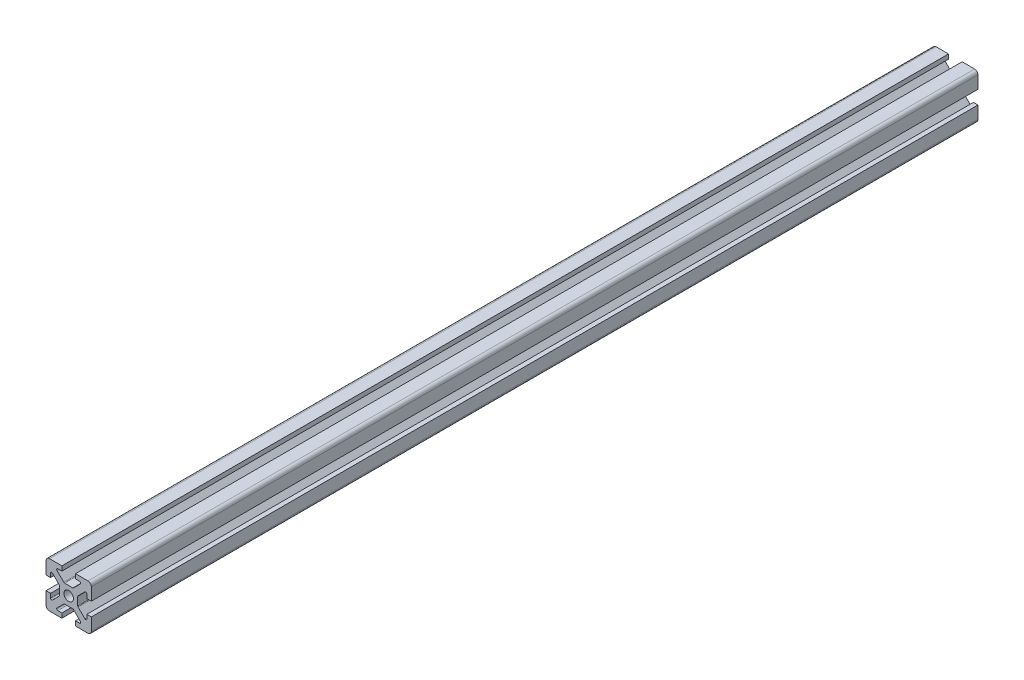
from build123d import *

# Parameters (mm, degrees)
SKETCH_1_W          = 20
SKETCH_1_H          = 20
EXTRUDE_1_DEPTH     = 391
FILLET_1_R          = 1.5
SKETCH_2_R          = 2.1
CUT_EXTRUDE_1_DEPTH = 392.255670885


with BuildPart() as part:
    # 草圖1 → 填料-伸長1 (new body)
    with BuildSketch(Plane.XY):
        Rectangle(SKETCH_1_W, SKETCH_1_H)
    extrude(amount=EXTRUDE_1_DEPTH)

    # 圓角1
    fillet_1_edges = [part.edges().sort_by_distance(p)[0] for p in [
        (-10, 10, 195.5),
        (10, 10, 195.5),
        (10, -10, 195.5),
        (-10, -10, 195.5),
    ]]
    fillet(fillet_1_edges, radius=FILLET_1_R)

    # 草圖2 → 除料-伸長1 (cut, through all)
    with BuildSketch(Plane.XY.offset(391)):
        Circle(SKETCH_2_R)
        with BuildLine():
            Line((10, 3), (8, 3))
            Line((8, 3), (8, 4.792893219))
            ThreePointArc((8, 4.792893219), (7.691341716, 5.254832985), (7.146446609, 5.146446609))
            Line((7.146446609, 5.146446609), (4.146446609, 2.146446609))
            ThreePointArc((4.146446609, 2.146446609), (4.038060234, 1.984234935), (4, 1.792893219))
            Line((4, 1.792893219), (4, -1.792893219))
            ThreePointArc((4, -1.792893219), (4.038060234, -1.984234935), (4.146446609, -2.146446609))
            Line((4.146446609, -2.146446609), (7.146446609, -5.146446609))
            ThreePointArc((7.146446609, -5.146446609), (7.691341716, -5.254832985), (8, -4.792893219))
            Line((8, -4.792893219), (8, -3))
            Line((8, -3), (10, -3))
            Line((10, -3), (10, 3))
        make_face()
        with BuildLine():
            Line((-3, -10), (3, -10))
            Line((3, -10), (3, -8))
            Line((3, -8), (4.792893219, -8))
            ThreePointArc((4.792893219, -8), (5.254832985, -7.691341716), (5.146446609, -7.146446609))
            Line((5.146446609, -7.146446609), (2.146446609, -4.146446609))
            ThreePointArc((2.146446609, -4.146446609), (1.984234935, -4.038060234), (1.792893219, -4))
            Line((1.792893219, -4), (-1.792893219, -4))
            ThreePointArc((-1.792893219, -4), (-1.984234935, -4.038060234), (-2.146446609, -4.146446609))
            Line((-2.146446609, -4.146446609), (-5.146446609, -7.146446609))
            ThreePointArc((-5.146446609, -7.146446609), (-5.254832985, -7.691341716), (-4.792893219, -8))
            Line((-4.792893219, -8), (-3, -8))
            Line((-3, -8), (-3, -10))
        make_face()
        with BuildLine():
            Line((-10, 3), (-10, -3))
            Line((-10, -3), (-8, -3))
            Line((-8, -3), (-8, -4.792893219))
            ThreePointArc((-8, -4.792893219), (-7.691341716, -5.254832985), (-7.146446609, -5.146446609))
            Line((-7.146446609, -5.146446609), (-4.146446609, -2.146446609))
            ThreePointArc((-4.146446609, -2.146446609), (-4.038060234, -1.984234935), (-4, -1.792893219))
            Line((-4, -1.792893219), (-4, 1.792893219))
            ThreePointArc((-4, 1.792893219), (-4.038060234, 1.984234935), (-4.146446609, 2.146446609))
            Line((-4.146446609, 2.146446609), (-7.146446609, 5.146446609))
            ThreePointArc((-7.146446609, 5.146446609), (-7.691341716, 5.254832985), (-8, 4.792893219))
            Line((-8, 4.792893219), (-8, 3))
            Line((-8, 3), (-10, 3))
        make_face()
        with BuildLine():
            Line((3, 10), (-3, 10))
            Line((-3, 10), (-3, 8))
            Line((-3, 8), (-4.792893219, 8))
            ThreePointArc((-4.792893219, 8), (-5.254832985, 7.691341716), (-5.146446609, 7.146446609))
            Line((-5.146446609, 7.146446609), (-2.146446609, 4.146446609))
            ThreePointArc((-2.146446609, 4.146446609), (-1.984234935, 4.038060234), (-1.792893219, 4))
            Line((-1.792893219, 4), (1.792893219, 4))
            ThreePointArc((1.792893219, 4), (1.984234935, 4.038060234), (2.146446609, 4.146446609))
            Line((2.146446609, 4.146446609), (5.146446609, 7.146446609))
            ThreePointArc((5.146446609, 7.146446609), (5.254832985, 7.691341716), (4.792893219, 8))
            Line((4.792893219, 8), (3, 8))
            Line((3, 8), (3, 10))
        make_face()
    extrude(amount=-CUT_EXTRUDE_1_DEPTH, mode=Mode.SUBTRACT)


solid = part.part
